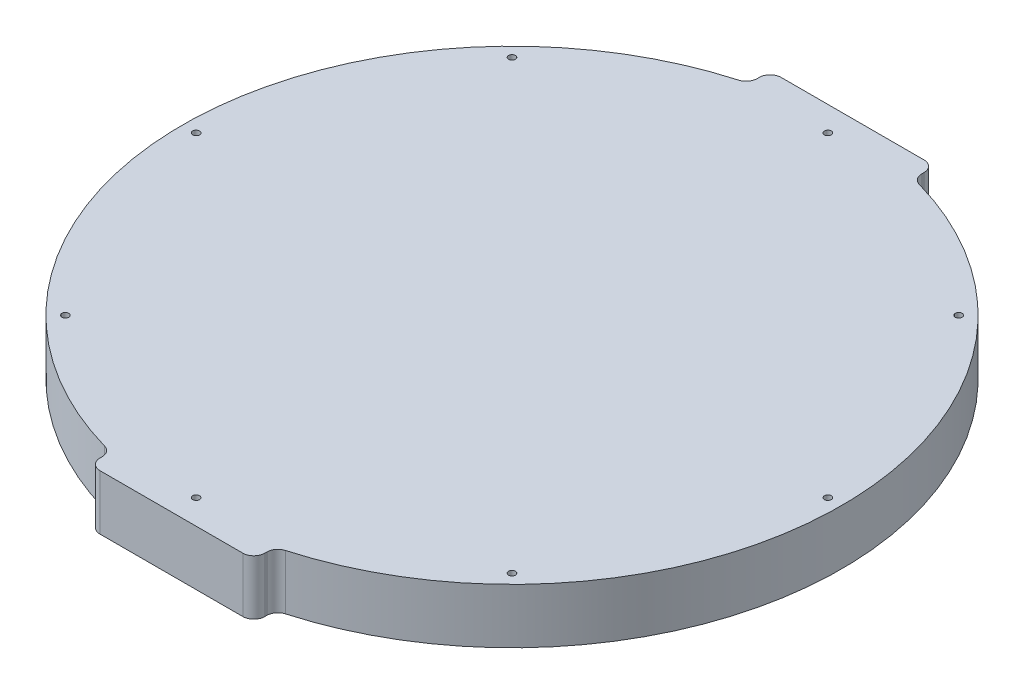
from build123d import *

# Parameters (mm, degrees)
SKETCH2_R                = 76.2
BOSS_EXTRUDE1_DEPTH      = 12.7
BOSS_EXTRUDE2_DEPTH      = 78.74
BOSS_EXTRUDE2_DEPTH_BACK = 78.74
FILLET1_R                = 2.54
SKETCH4_R                = 0.79375
CUT_EXTRUDE1_DEPTH       = 111.307377813


with BuildPart() as part:
    # Sketch2 → Boss-Extrude1 (new body)
    with BuildSketch(Plane(origin=(0, 0, 0), x_dir=(1, 0, 0), z_dir=(0, 1, 0))):
        with Locations(Location((0, 0, 0), (0, 0, 270))):
            Circle(SKETCH2_R)
    extrude(amount=BOSS_EXTRUDE1_DEPTH)

    # Sketch3 → Boss-Extrude2 (add, two sides: drawn at the far end of the back side and taken through both)
    with BuildSketch(Plane.XY.offset(-BOSS_EXTRUDE2_DEPTH_BACK)):
        Polygon((0, 0), (-19.05, 0), (-19.05, 12.7), (19.05, 12.7), (19.05, 0), align=None)
    extrude(amount=BOSS_EXTRUDE2_DEPTH + BOSS_EXTRUDE2_DEPTH_BACK)

    # Fillet1
    fillet1_edges = [part.edges().sort_by_distance(p)[0] for p in [
        (-19.05, 6.35, -78.74),
        (19.05, 6.35, -78.74),
        (-19.05, 6.35, -73.780332745),
        (-19.05, 6.35, 73.780332745),
        (19.05, 6.35, 73.780332745),
        (19.05, 6.35, -73.780332745),
        (19.05, 6.35, 78.74),
        (-19.05, 6.35, 78.74),
    ]]
    fillet(fillet1_edges, radius=FILLET1_R)

    # Sketch4 → Cut-Extrude1 (cut, through all)
    with BuildSketch(Plane(origin=(0, 12.7, 0), x_dir=(1, 0, 0), z_dir=(0, 1, 0))):
        with Locations(Location((73.025, 0, 0), (0, 0, 270))):
            Circle(SKETCH4_R)
        with Locations(Location((51.636472696, -51.636472696, 0), (0, 0, 270))):
            Circle(SKETCH4_R)
        with Locations(Location((0, -73.025, 0), (0, 0, 270))):
            Circle(SKETCH4_R)
        with Locations(Location((-51.636472696, -51.636472696, 0), (0, 0, 270))):
            Circle(SKETCH4_R)
        with Locations(Location((-73.025, 0, 0), (0, 0, 270))):
            Circle(SKETCH4_R)
        with Locations(Location((-51.636472696, 51.636472696, 0), (0, 0, 270))):
            Circle(SKETCH4_R)
        with Locations(Location((0, 73.025, 0), (0, 0, 270))):
            Circle(SKETCH4_R)
        with Locations(Location((51.636472696, 51.636472696, 0), (0, 0, 270))):
            Circle(SKETCH4_R)
    extrude(amount=-CUT_EXTRUDE1_DEPTH, mode=Mode.SUBTRACT)


solid = part.part
